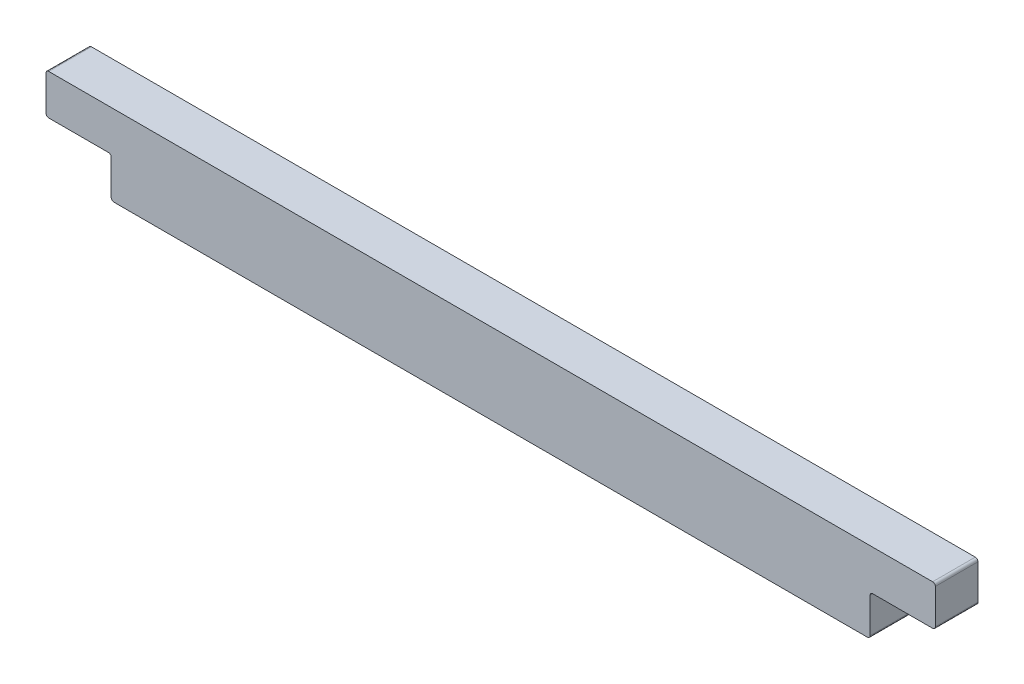
from build123d import *

# Parameters (mm, degrees)
SKETCH1_W           = 66.16
SKETCH1_H           = 6
BOSS_EXTRUDE1_DEPTH = 3.175
SKETCH2_W           = 4.85
SKETCH2_H           = 3
CUT_EXTRUDE1_DEPTH  = 34.367154883
FILLET1_R           = 0.2


with BuildPart() as part:
    # Sketch1 → Boss-Extrude1 (new body)
    with BuildSketch(Plane.XY):
        Rectangle(SKETCH1_W, SKETCH1_H)
    extrude(amount=BOSS_EXTRUDE1_DEPTH)

    # Sketch2 → Cut-Extrude1 (cut, through all)
    with BuildSketch(Plane.XY.offset(3.175)):
        with Locations((-30.655, -1.5)):
            Rectangle(SKETCH2_W, SKETCH2_H)
        with Locations((30.655, -1.5)):
            Rectangle(SKETCH2_W, SKETCH2_H)
    extrude(amount=-CUT_EXTRUDE1_DEPTH, mode=Mode.SUBTRACT)

    # Fillet1
    fillet1_edges = [part.edges().sort_by_distance(p)[0] for p in [
        (-33.08, 0, 1.5875),
        (-28.23, 0, 1.5875),
        (-28.23, -3, 1.5875),
        (33.08, 0, 1.5875),
        (28.23, -3, 1.5875),
        (28.23, 0, 1.5875),
        (-33.08, 3, 1.5875),
        (33.08, 3, 1.5875),
    ]]
    fillet(fillet1_edges, radius=FILLET1_R)


solid = part.part
